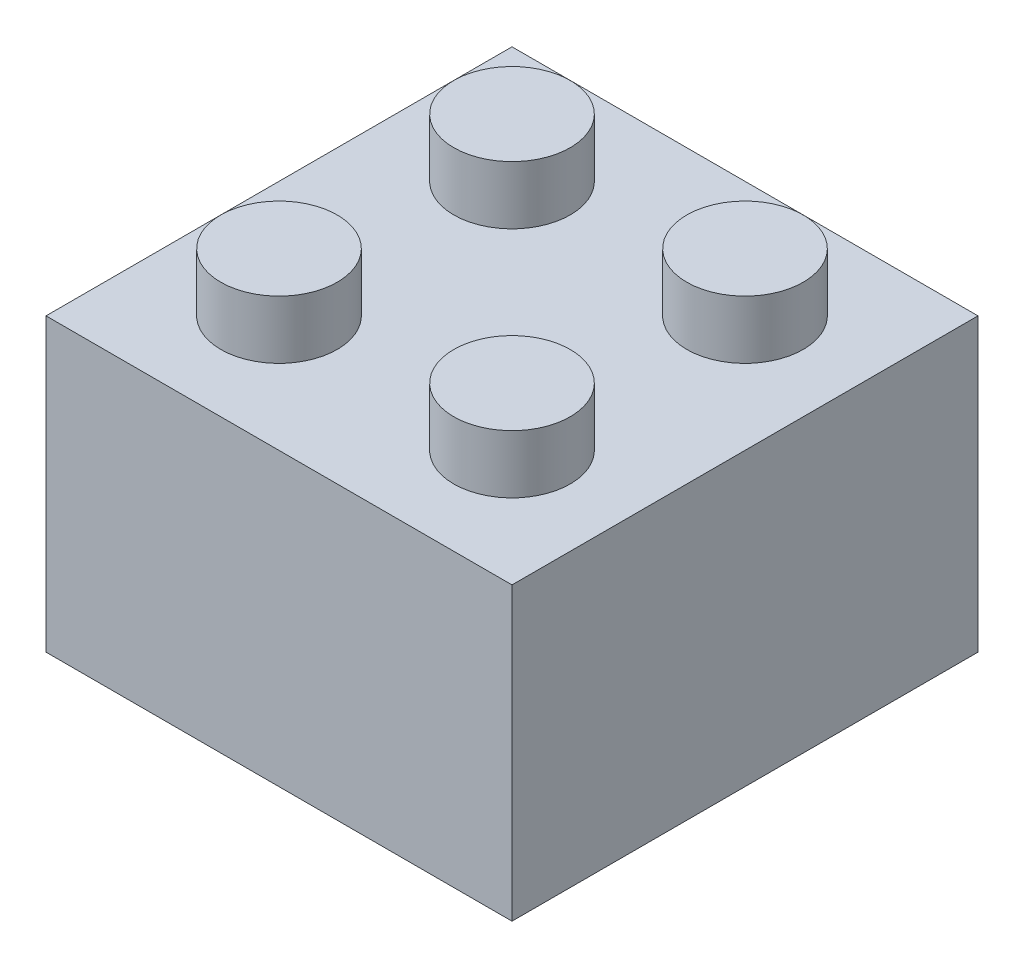
from build123d import *

# Parameters (mm, degrees)
SKETCH1_W           = 16
SKETCH1_H           = 16
BOSS_EXTRUDE1_DEPTH = 10
SKETCH2_R           = 2
BOSS_EXTRUDE2_DEPTH = 2
SHELL1_T            = -1
SKETCH3_R           = 2.7
SKETCH3_R_2         = 1.7
BOSS_EXTRUDE3_DEPTH = 9


with BuildPart() as part:
    # Sketch1 → Boss-Extrude1 (new body)
    with BuildSketch(Plane(origin=(0, 0, 0), x_dir=(1, 0, 0), z_dir=(0, 1, 0))):
        Rectangle(SKETCH1_W, SKETCH1_H)
    extrude(amount=BOSS_EXTRUDE1_DEPTH)

    # Sketch2 → Boss-Extrude2 (add)
    with BuildSketch(Plane(origin=(0, 10, 0), x_dir=(1, 0, 0), z_dir=(0, 1, 0))):
        with Locations(Location((-4, 4, 0), (0, 0, 270))):
            Circle(SKETCH2_R)
        with Locations(Location((4, 4, 0), (0, 0, 270))):
            Circle(SKETCH2_R)
        with Locations(Location((-4, -4, 0), (0, 0, 270))):
            Circle(SKETCH2_R)
        with Locations(Location((4, -4, 0), (0, 0, 270))):
            Circle(SKETCH2_R)
    extrude(amount=BOSS_EXTRUDE2_DEPTH)

    # Shell1
    shell1_openings = [part.faces().sort_by_distance(p)[0] for p in [
        (0, 0, 0),
    ]]
    offset(amount=SHELL1_T, openings=shell1_openings, kind=Kind.INTERSECTION)

    # Sketch3 → Boss-Extrude3 (add)
    with BuildSketch(Plane.XZ.offset(-9)):
        with Locations(Location((0, 0, 0), (0, 0, 90))):
            Circle(SKETCH3_R)
        with Locations(Location((0, 0, 0), (0, 0, 270))):
            Circle(SKETCH3_R_2, mode=Mode.SUBTRACT)
    extrude(amount=BOSS_EXTRUDE3_DEPTH)


solid = part.part
